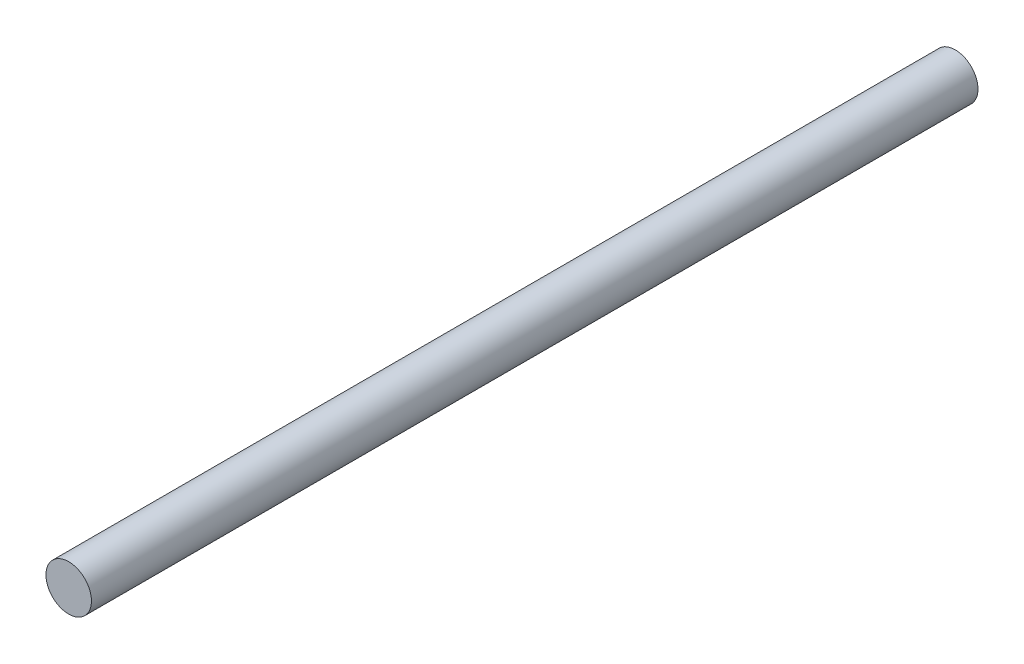
from build123d import *

# Parameters (mm, degrees)
SKETCH1_R           = 10
BOSS_EXTRUDE1_DEPTH = 390


with BuildPart() as part:
    # Sketch1 → Boss-Extrude1 (new body)
    with BuildSketch(Plane.XY):
        Circle(SKETCH1_R)
    extrude(amount=-BOSS_EXTRUDE1_DEPTH)


solid = part.part
